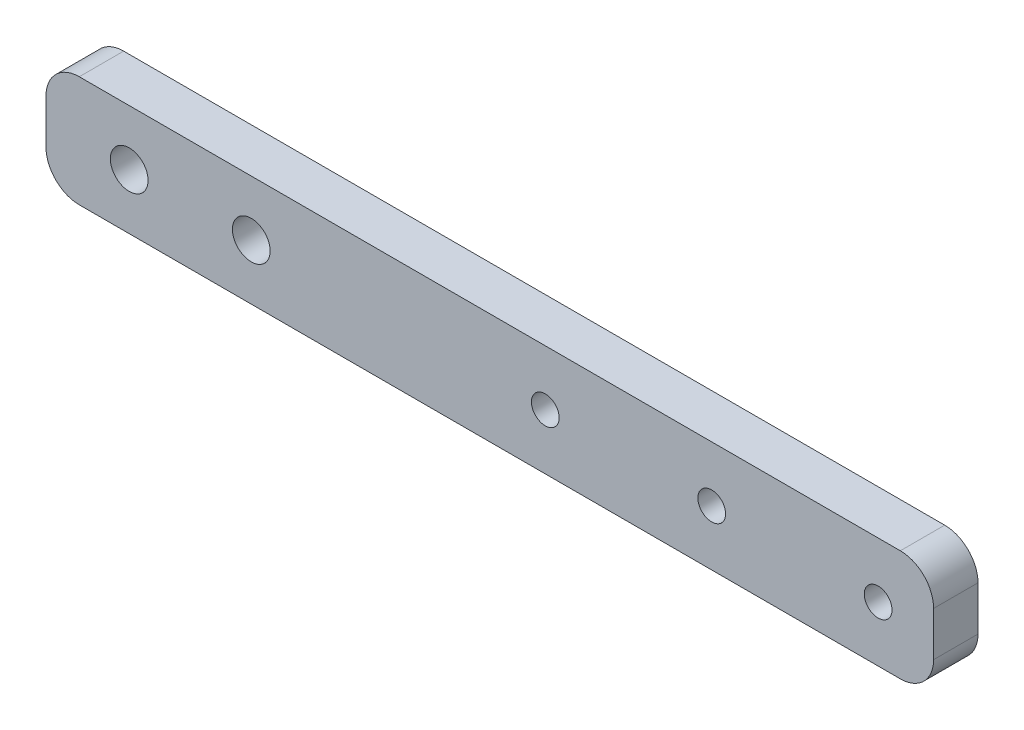
from build123d import *

# Parameters (mm, degrees)
SKETCH_1_W      = 80
SKETCH_1_H      = 10
SKETCH_1_R      = 1.25
SKETCH_1_R_2    = 1.7
EXTRUDE_1_DEPTH = 4
FILLET_1_R      = 3


with BuildPart() as part:
    # 草图1 → 凸台-拉伸1 (new body)
    with BuildSketch(Plane.XY):
        with Locations((40, 5)):
            Rectangle(SKETCH_1_W, SKETCH_1_H)
        with Locations((45, 5)):
            Circle(SKETCH_1_R, mode=Mode.SUBTRACT)
        with Locations((60, 5)):
            Circle(SKETCH_1_R, mode=Mode.SUBTRACT)
        with Locations((75, 5)):
            Circle(SKETCH_1_R, mode=Mode.SUBTRACT)
        with Locations((7.5, 5)):
            Circle(SKETCH_1_R_2, mode=Mode.SUBTRACT)
        with Locations((18.5, 5)):
            Circle(SKETCH_1_R_2, mode=Mode.SUBTRACT)
    extrude(amount=EXTRUDE_1_DEPTH)

    # 圆角1
    fillet_1_edges = [part.edges().sort_by_distance(p)[0] for p in [
        (0, 10, 2),
        (80, 10, 2),
        (80, 0, 2),
        (0, 0, 2),
    ]]
    fillet(fillet_1_edges, radius=FILLET_1_R)


solid = part.part
